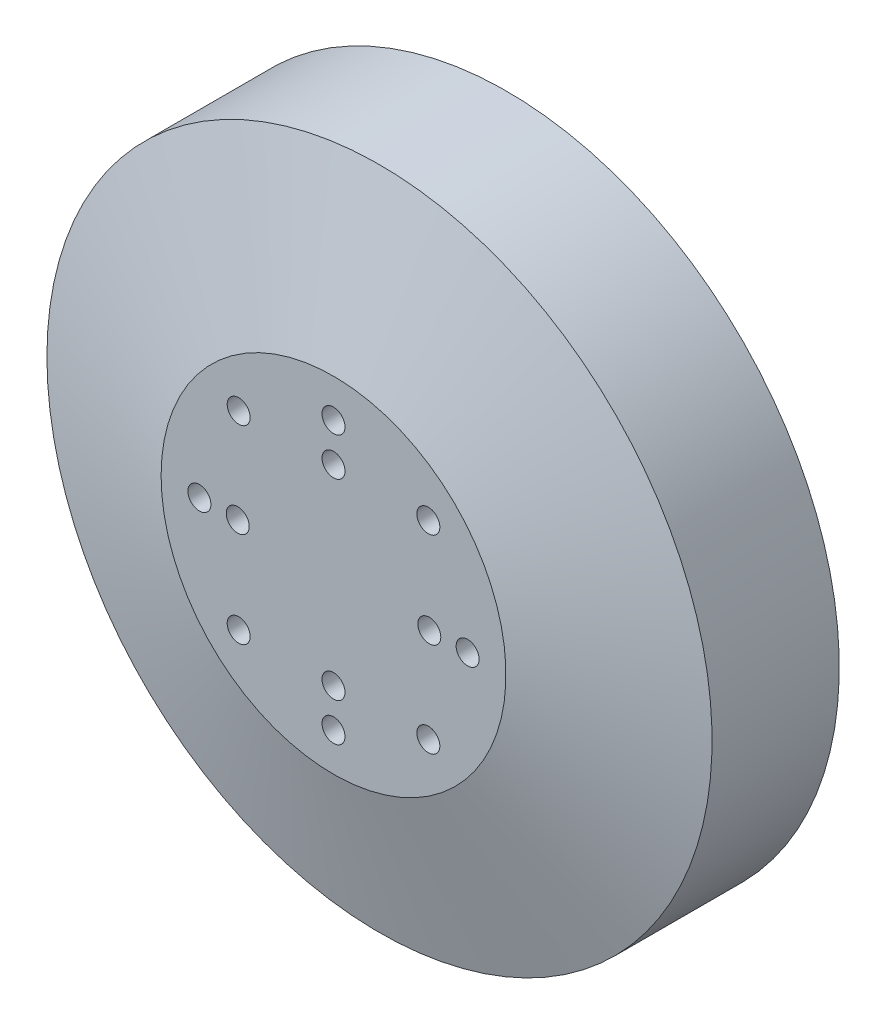
from build123d import *

# Parameters (mm, degrees)
SKETCH1_R           = 43.4
BOSS_EXTRUDE1_DEPTH = 13.3
SKETCH3_R           = 1.5
SKETCH3_R_2         = 2
CUT_EXTRUDE1_DEPTH  = 10
SKETCH4_R           = 1.5
CUT_EXTRUDE2_DEPTH  = 5


with BuildPart() as part:
    # Sketch1 → Boss-Extrude1 (new, symmetric)
    with BuildSketch(Plane.XY):
        Circle(SKETCH1_R)
    extrude(amount=BOSS_EXTRUDE1_DEPTH, both=True)

    # Sketch2 → Cut-Revolve1 (revolve, cut)
    with BuildSketch(Plane(origin=(0, 0, 0), x_dir=(1, 0, 0), z_dir=(0, 1, 0))):
        Polygon((-43.4, -7.3), (-22.5, -13.3), (-43.4, -13.3), align=None)
        Polygon((-43.4, 9.3), (-43.4, 13.3), (-20, 13.3), (-40.4, 10.8), (-40.4, 9.3), align=None)
    revolve(axis=Axis((0, 0, -13.3), (0, 0, 1)), mode=Mode.SUBTRACT)

    # Sketch3 → Cut-Extrude1 (cut)
    with BuildSketch(Plane(origin=(0, 0, -13.3), x_dir=(-1, 0, 0), z_dir=(0, 0, -1))):
        with Locations((10.606601718, 10.606601718)):
            Circle(SKETCH3_R)
        with Locations((10.606601718, -10.606601718)):
            Circle(SKETCH3_R)
        with Locations((-10.606601718, -10.606601718)):
            Circle(SKETCH3_R)
        with Locations((-10.606601718, 10.606601718)):
            Circle(SKETCH3_R)
        with Locations((0, 16)):
            Circle(SKETCH3_R_2)
        with Locations((16, 0)):
            Circle(SKETCH3_R_2)
        with Locations((0, -16)):
            Circle(SKETCH3_R_2)
        with Locations((-16, 0)):
            Circle(SKETCH3_R_2)
    extrude(amount=-CUT_EXTRUDE1_DEPTH, mode=Mode.SUBTRACT)

    # Sketch4 → Cut-Extrude2 (cut)
    with BuildSketch(Plane.XY.offset(13.3)):
        with Locations((0, 17.5)):
            Circle(SKETCH4_R)
        with Locations((0, 12.5)):
            Circle(SKETCH4_R)
        with Locations((12.374368671, 12.374368671)):
            Circle(SKETCH4_R)
        with Locations((17.5, 0)):
            Circle(SKETCH4_R)
        with Locations((12.374368671, -12.374368671)):
            Circle(SKETCH4_R)
        with Locations((0, -17.5)):
            Circle(SKETCH4_R)
        with Locations((-12.374368671, -12.374368671)):
            Circle(SKETCH4_R)
        with Locations((-17.5, 0)):
            Circle(SKETCH4_R)
        with Locations((-12.374368671, 12.374368671)):
            Circle(SKETCH4_R)
        with Locations((12.5, 0)):
            Circle(SKETCH4_R)
        with Locations((0, -12.5)):
            Circle(SKETCH4_R)
        with Locations((-12.5, 0)):
            Circle(SKETCH4_R)
    extrude(amount=-CUT_EXTRUDE2_DEPTH, mode=Mode.SUBTRACT)


solid = part.part
